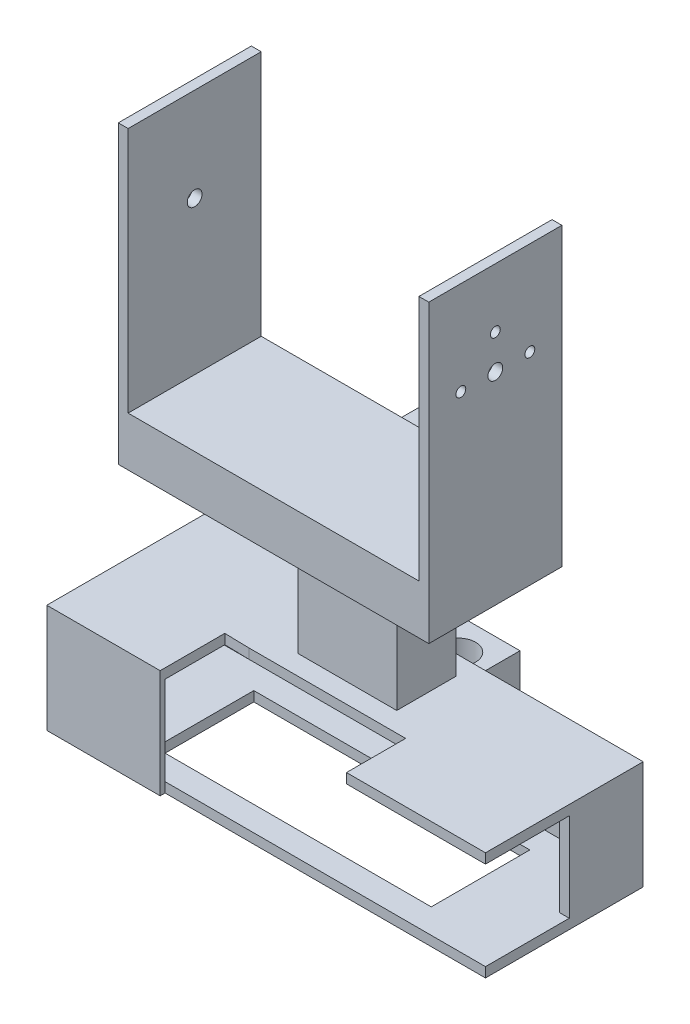
from build123d import *

# Parameters (mm, degrees)
SKETCH1_W           = 63
SKETCH1_H           = 27
BOSS_EXTRUDE1_DEPTH = 60
SKETCH2_W           = 59
SKETCH2_H           = 27
CUT_EXTRUDE1_DEPTH  = 50
SKETCH3_R           = 1.5
CUT_EXTRUDE2_DEPTH  = 65
SKETCH5_W           = 20
SKETCH5_H           = 12
BOSS_EXTRUDE2_DEPTH = 30
SKETCH6_W           = 88
SKETCH6_H           = 32
BOSS_EXTRUDE3_DEPTH = 22
SKETCH7_W           = 83
SKETCH7_H           = 18
CUT_EXTRUDE3_DEPTH  = 30
SKETCH10_W          = 56
SKETCH10_H          = 20
CUT_EXTRUDE5_DEPTH  = 3
SKETCH11_W          = 23
SKETCH11_H          = 22
BOSS_EXTRUDE4_DEPTH = 1
SKETCH12_W          = 17
SKETCH12_H          = 18
CUT_EXTRUDE7_DEPTH  = 2.5
SKETCH13_W          = 31.74972829
SKETCH13_H          = 12
CUT_EXTRUDE9_DEPTH  = 2.5
CUT_EXTRUDE10_DEPTH = 2.5
SKETCH23_W          = 12
SKETCH23_H          = 10
BOSS_EXTRUDE7_DEPTH = 13
SKETCH25_R          = 3.5
CUT_EXTRUDE13_DEPTH = 13
SKETCH26_W          = 12
SKETCH26_H          = 10
BOSS_EXTRUDE8_DEPTH = 17
SKETCH27_R          = 3.5
CUT_EXTRUDE14_DEPTH = 17
SKETCH28_R          = 1
CUT_EXTRUDE15_DEPTH = 10


with BuildPart() as part:
    # Sketch1 → Boss-Extrude1 (new body)
    with BuildSketch(Plane(origin=(0, 0, 0), x_dir=(1, 0, 0), z_dir=(0, 1, 0))):
        Rectangle(SKETCH1_W, SKETCH1_H)
    extrude(amount=BOSS_EXTRUDE1_DEPTH)

    # Sketch2 → Cut-Extrude1 (cut)
    with BuildSketch(Plane(origin=(0, 60, 0), x_dir=(1, 0, 0), z_dir=(0, 1, 0))):
        Rectangle(SKETCH2_W, SKETCH2_H)
    extrude(amount=-CUT_EXTRUDE1_DEPTH, mode=Mode.SUBTRACT)

    # Sketch3 → Cut-Extrude2 (cut)
    with BuildSketch(Plane(origin=(31.5, 0, 0), x_dir=(0, 0, -1), z_dir=(1, 0, 0))):
        with Locations((0, 41)):
            Circle(SKETCH3_R)
    extrude(amount=-CUT_EXTRUDE2_DEPTH, mode=Mode.SUBTRACT)

    # Sketch5 → Boss-Extrude2 (add)
    with BuildSketch(Plane.XZ):
        with Locations((0, -7.5)):
            Rectangle(SKETCH5_W, SKETCH5_H)
    extrude(amount=BOSS_EXTRUDE2_DEPTH)

    # Sketch6 → Boss-Extrude3 (add)
    with BuildSketch(Plane.XZ.offset(30)):
        with Locations((0, -1.5)):
            Rectangle(SKETCH6_W, SKETCH6_H)
    extrude(amount=BOSS_EXTRUDE3_DEPTH)

    # Sketch7 → Cut-Extrude3 (cut)
    with BuildSketch(Plane.XY.offset(14.5)):
        with Locations((0.5, -41)):
            Rectangle(SKETCH7_W, SKETCH7_H)
    extrude(amount=-CUT_EXTRUDE3_DEPTH, mode=Mode.SUBTRACT)

    # Sketch10 → Cut-Extrude5 (cut)
    with BuildSketch(Plane.XZ.offset(52)):
        with Locations((0, -0.5)):
            Rectangle(SKETCH10_W, SKETCH10_H)
    extrude(amount=-CUT_EXTRUDE5_DEPTH, mode=Mode.SUBTRACT)

    # Sketch11 → Boss-Extrude4 (add)
    with BuildSketch(Plane.XY.offset(14.5)):
        with Locations((-32.5, -41)):
            Rectangle(SKETCH11_W, SKETCH11_H)
    extrude(amount=BOSS_EXTRUDE4_DEPTH)

    # Sketch12 → Cut-Extrude7 (cut)
    with BuildSketch(Plane(origin=(44, 0, 0), x_dir=(0, 0, -1), z_dir=(1, 0, 0))):
        with Locations((-6, -41)):
            Rectangle(SKETCH12_W, SKETCH12_H)
    extrude(amount=-CUT_EXTRUDE7_DEPTH, mode=Mode.SUBTRACT)

    # Sketch13 → Cut-Extrude9 (cut)
    with BuildSketch(Plane(origin=(0, -30, 0), x_dir=(1, 0, 0), z_dir=(0, 1, 0))):
        with Locations((-0.07313141, -8.5)):
            Rectangle(SKETCH13_W, SKETCH13_H)
    extrude(amount=-CUT_EXTRUDE9_DEPTH, mode=Mode.SUBTRACT)

    # Sketch16 → Cut-Extrude10 (cut)
    with BuildSketch(Plane(origin=(0, -30, 0), x_dir=(1, 0, 0), z_dir=(0, 1, 0))):
        Polygon((-21, -14.5), (-21, -2.38991446), (-15.947995555, -2.5), (-15.947995555, -14.5), align=None)
    extrude(amount=-CUT_EXTRUDE10_DEPTH, mode=Mode.SUBTRACT)

    # Sketch23 → Boss-Extrude7 (add)
    with BuildSketch(Plane(origin=(0, 0, -17.5), x_dir=(-1, 0, 0), z_dir=(0, 0, -1))):
        with Locations((0, -41)):
            Rectangle(SKETCH23_W, SKETCH23_H)
    extrude(amount=BOSS_EXTRUDE7_DEPTH)

    # Sketch25 → Cut-Extrude13 (cut)
    with BuildSketch(Plane(origin=(0, -36, 0), x_dir=(1, 0, 0), z_dir=(0, 1, 0))):
        with Locations(Location((0, 24, 0), (0, 0, 270))):
            Circle(SKETCH25_R)
    extrude(amount=-CUT_EXTRUDE13_DEPTH, mode=Mode.SUBTRACT)

    # Sketch26 → Boss-Extrude8 (add)
    with BuildSketch(Plane(origin=(0, 0, -13.5), x_dir=(-1, 0, 0), z_dir=(0, 0, -1))):
        Rectangle(SKETCH26_W, SKETCH26_H)
    extrude(amount=BOSS_EXTRUDE8_DEPTH)

    # Sketch27 → Cut-Extrude14 (cut)
    with BuildSketch(Plane(origin=(0, 5, 0), x_dir=(1, 0, 0), z_dir=(0, 1, 0))):
        with Locations(Location((0, 24, 0), (0, 0, 270))):
            Circle(SKETCH27_R)
    extrude(amount=-CUT_EXTRUDE14_DEPTH, mode=Mode.SUBTRACT)

    # Sketch28 → Cut-Extrude15 (cut)
    with BuildSketch(Plane(origin=(31.5, 0, 0), x_dir=(0, 0, -1), z_dir=(1, 0, 0))):
        with Locations((0, 48)):
            Circle(SKETCH28_R)
        with Locations((7, 41)):
            Circle(SKETCH28_R)
        with Locations((-7, 41)):
            Circle(SKETCH28_R)
    extrude(amount=-CUT_EXTRUDE15_DEPTH, mode=Mode.SUBTRACT)


solid = part.part
